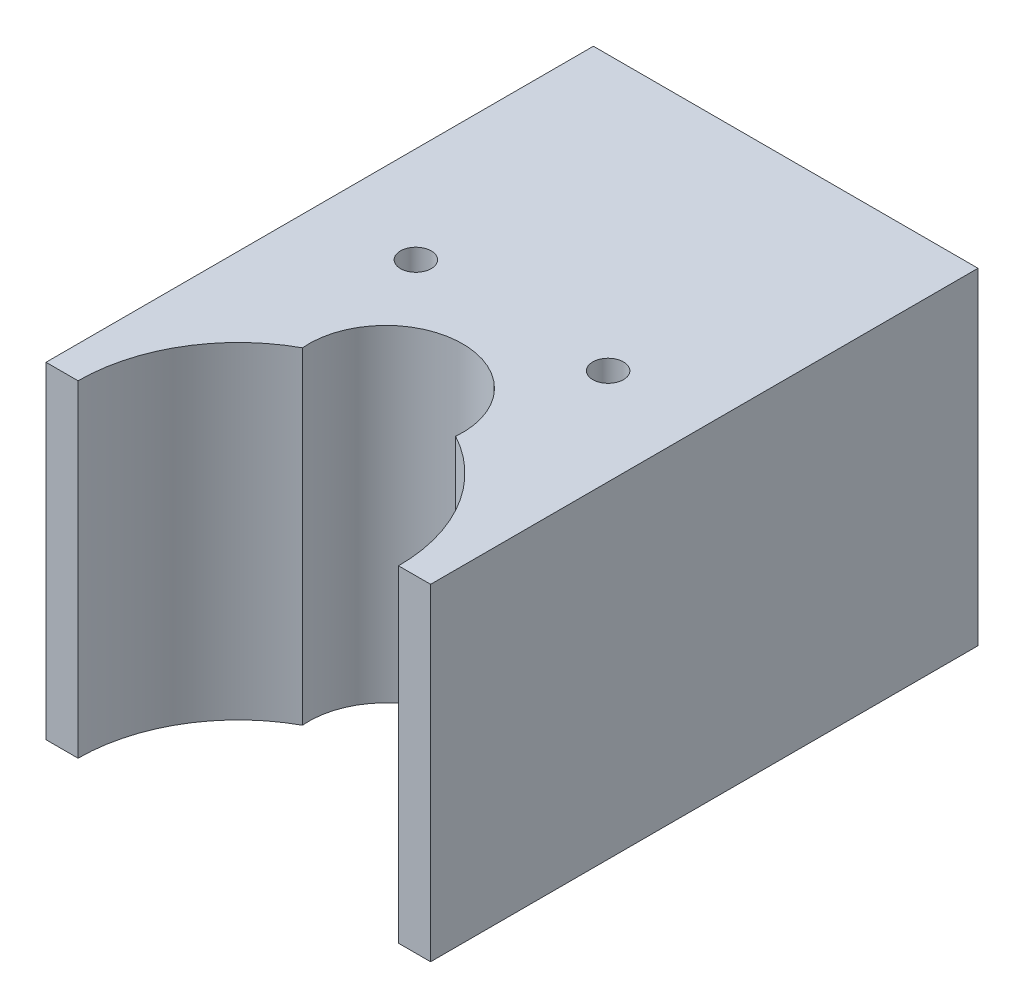
from build123d import *

# Parameters (mm, degrees)
SKETCH_1_W           = 15
SKETCH_1_H           = 32.4
EXTRUDE_1_DEPTH      = 12.75
SKETCH_1_3_R         = 6.25
SKETCH_1_3_R_2       = 3
CUT_EXTRUDE_1_DEPTH  = 38.912036347
SKETCH_2_OUTSIDE_W   = 24.582
SKETCH_2_OUTSIDE_H   = 41.982
SKETCH_2_OUTSIDE_W_2 = 15
SKETCH_2_OUTSIDE_H_2 = 21.35
CUT_EXTRUDE_2_DEPTH  = 38.912036347
SKETCH_3_R           = 0.6
CUT_EXTRUDE_3_DEPTH  = 3
SKETCH_4_R           = 0.6
CUT_EXTRUDE_4_DEPTH  = 3


with BuildPart() as part:
    # 草图1 → 凸台-拉伸1 (new body)
    with BuildSketch(Plane(origin=(0, 0, 0), x_dir=(1, 0, 0), z_dir=(0, 1, 0))):
        with Locations((7.5, -16.2)):
            Rectangle(SKETCH_1_W, SKETCH_1_H)
    extrude(amount=EXTRUDE_1_DEPTH)

    # 草图1<3> → 切除-拉伸1 (cut, through all)
    with BuildSketch(Plane(origin=(0, 0, 0), x_dir=(1, 0, 0), z_dir=(0, 1, 0))):
        with Locations((7.5, -21.35)):
            Circle(SKETCH_1_3_R)
        with Locations((7.5, -15.6)):
            Circle(SKETCH_1_3_R_2)
    extrude(amount=CUT_EXTRUDE_1_DEPTH, mode=Mode.SUBTRACT)

    # 草图2 outside → 切除-拉伸2 (cut, through all)
    with BuildSketch(Plane(origin=(0, 12.75, 0), x_dir=(1, 0, 0), z_dir=(0, 1, 0))):
        with Locations((7.5, -16.2)):
            Rectangle(SKETCH_2_OUTSIDE_W, SKETCH_2_OUTSIDE_H)
        with Locations((7.5, -10.675)):
            Rectangle(SKETCH_2_OUTSIDE_W_2, SKETCH_2_OUTSIDE_H_2, mode=Mode.SUBTRACT)
    extrude(amount=-CUT_EXTRUDE_2_DEPTH, mode=Mode.SUBTRACT)

    # 草图3 → 切除-拉伸3 (cut)
    with BuildSketch(Plane.XZ):
        with Locations((3.5, 11.35)):
            Circle(SKETCH_3_R)
        with Locations((11.5, 11.35)):
            Circle(SKETCH_3_R)
    extrude(amount=-CUT_EXTRUDE_3_DEPTH, mode=Mode.SUBTRACT)

    # 草图4 → 切除-拉伸4 (cut)
    with BuildSketch(Plane(origin=(0, 12.75, 0), x_dir=(1, 0, 0), z_dir=(0, 1, 0))):
        with Locations((11.25, -10.675)):
            Circle(SKETCH_4_R)
        with Locations((3.75, -10.675)):
            Circle(SKETCH_4_R)
    extrude(amount=-CUT_EXTRUDE_4_DEPTH, mode=Mode.SUBTRACT)


solid = part.part
